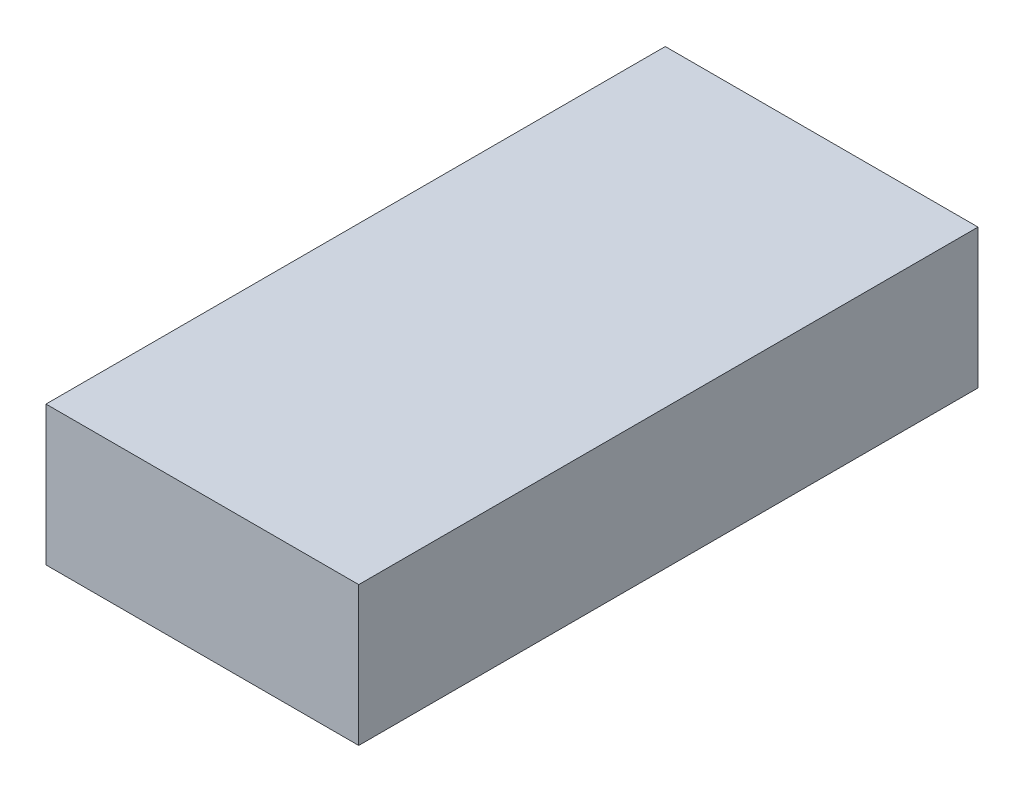
from build123d import *

# Parameters (mm, degrees)
SKETCH_1_W      = 20.2
SKETCH_1_H      = 40
EXTRUDE_1_DEPTH = 9


with BuildPart() as part:
    # Эскиз1 → Бобышка-Вытянуть1 (new body)
    with BuildSketch(Plane(origin=(0, 0, 0), x_dir=(1, 0, 0), z_dir=(0, 1, 0))):
        Rectangle(SKETCH_1_W, SKETCH_1_H)
    extrude(amount=EXTRUDE_1_DEPTH)


solid = part.part
